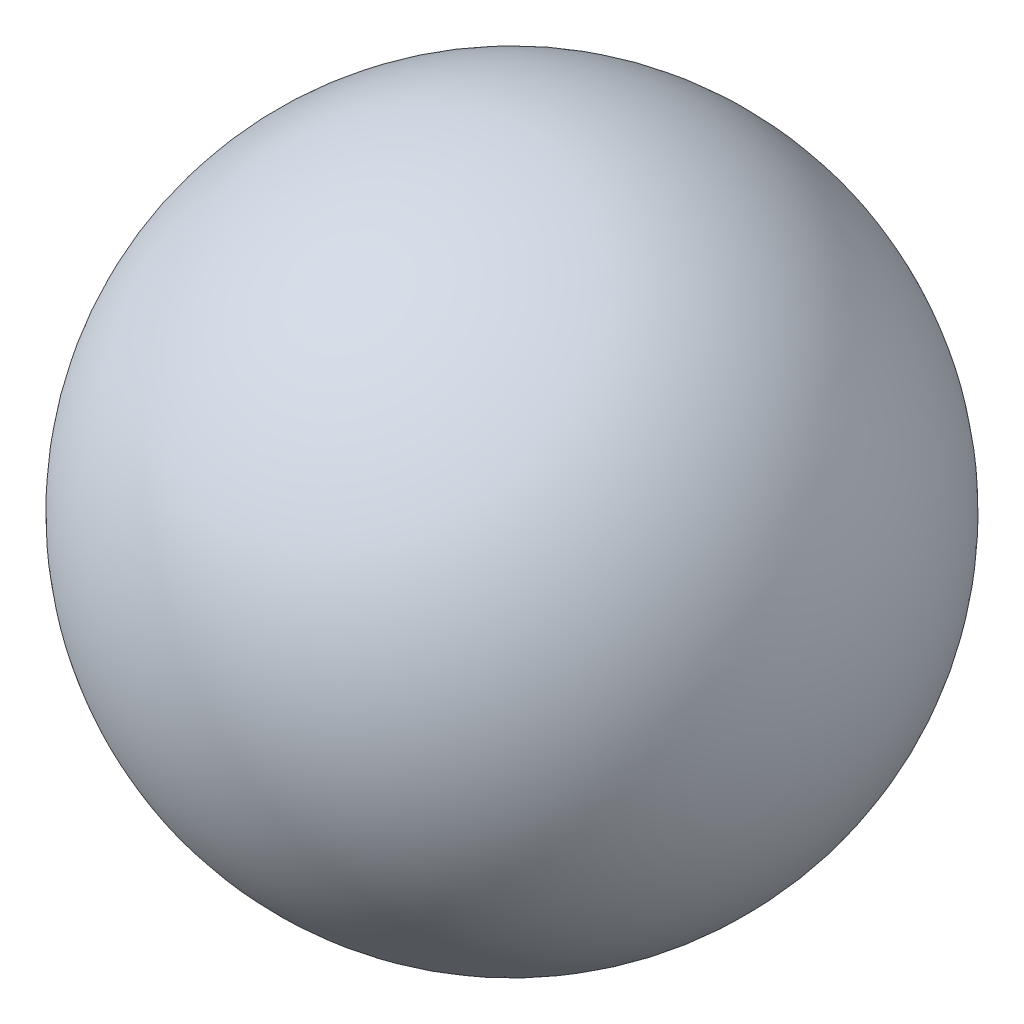
from build123d import *


with BuildPart() as part:
    # Sketch2 → Revolve1 (revolve)
    with BuildSketch(Plane(origin=(0, 0, 0), x_dir=(0, 0, -1), z_dir=(1, 0, 0))):
        with BuildLine():
            Line((2.35, 0), (-2.35, 0))
            ThreePointArc((-2.35, 0), (0, -2.35), (2.35, 0))
        make_face()
    revolve(axis=Axis((0, 0, 0), (0, 0, -1)))


solid = part.part
